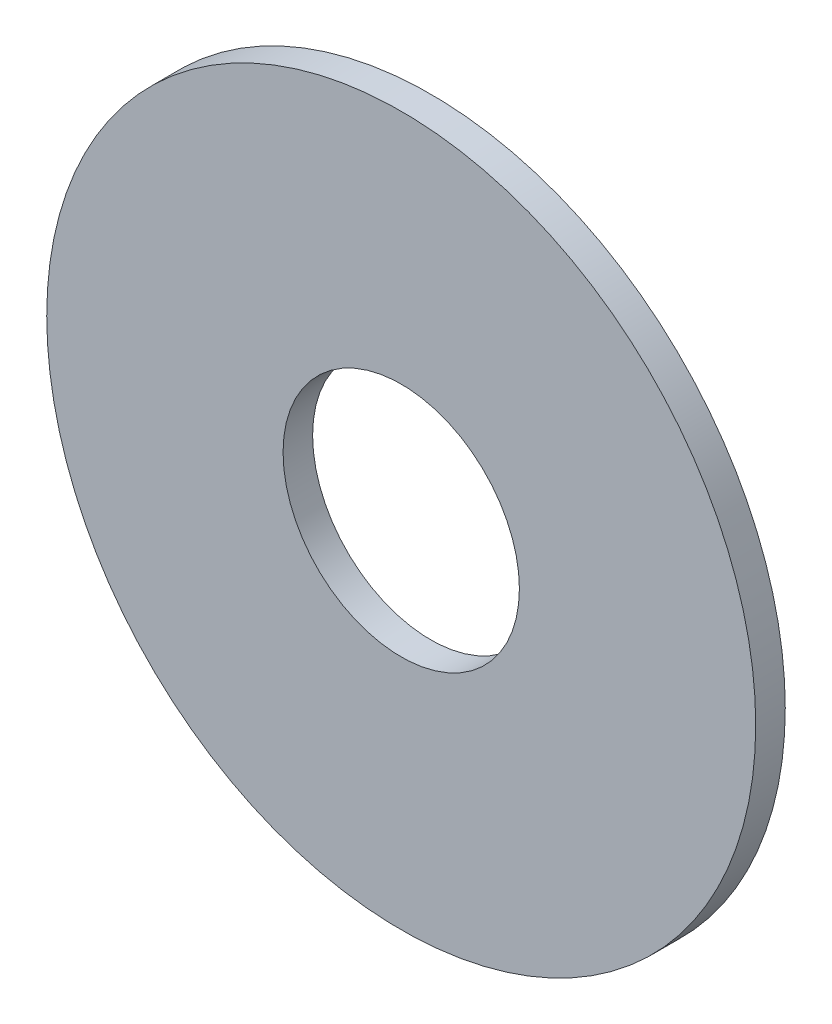
from build123d import *

# Parameters (mm, degrees)
SKETCH_1_R      = 6
SKETCH_1_R_2    = 2
EXTRUDE_1_DEPTH = 0.5


with BuildPart() as part:
    # 草图1 → 凸台-拉伸1 (new body)
    with BuildSketch(Plane.XY):
        Circle(SKETCH_1_R)
        Circle(SKETCH_1_R_2, mode=Mode.SUBTRACT)
    extrude(amount=EXTRUDE_1_DEPTH)


solid = part.part
